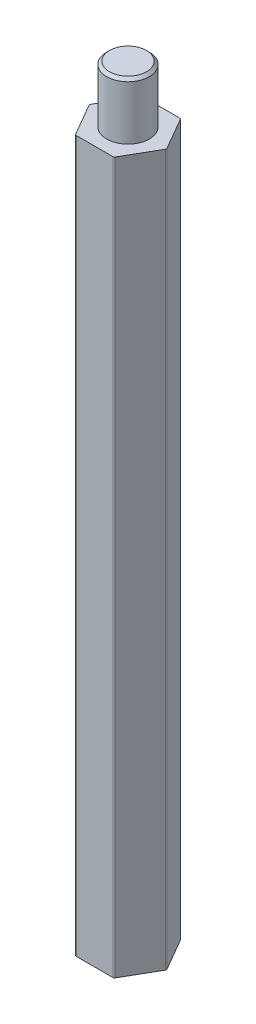
from build123d import *

# Parameters (mm, degrees)
EXTRUDE_1_DEPTH     = 50
SKETCH_2_R          = 1.5
EXTRUDE_2_DEPTH     = 4
SKETCH_3_R          = 1.5
CUT_EXTRUDE_1_DEPTH = 4
CHAMFER_1_SIZE      = 0.2
FILLET_1_R          = 0.1


with BuildPart() as part:
    # 草图1 → 凸台-拉伸1 (new body)
    with BuildSketch(Plane(origin=(0, 0, 0), x_dir=(1, 0, 0), z_dir=(0, 1, 0))):
        Polygon((2.713546265, 0), (1.356773133, 2.35), (-1.356773133, 2.35), (-2.713546265, 0), (-1.356773133, -2.35), (1.356773133, -2.35), align=None)
    extrude(amount=EXTRUDE_1_DEPTH)

    # 草图2 → 凸台-拉伸2 (add)
    with BuildSketch(Plane(origin=(0, 50, 0), x_dir=(1, 0, 0), z_dir=(0, 1, 0))):
        with Locations(Location((0, 0, 0), (0, 0, 270))):
            Circle(SKETCH_2_R)
    extrude(amount=EXTRUDE_2_DEPTH)

    # 草图3 → 切除-拉伸1 (cut)
    with BuildSketch(Plane.XZ):
        with Locations(Location((0, 0, 0), (0, 0, 90))):
            Circle(SKETCH_3_R)
    extrude(amount=-CUT_EXTRUDE_1_DEPTH, mode=Mode.SUBTRACT)

    # 倒角1
    chamfer_1_edges = [part.edges().sort_by_distance(p)[0] for p in [
        (0, 4, -1.5),
        (0, 54, -1.5),
    ]]
    chamfer(chamfer_1_edges, length=CHAMFER_1_SIZE)

    # 圆角1
    fillet_1_edges = [part.edges().sort_by_distance(p)[0] for p in [
        (2.713546265, 25, 0),
        (1.356773133, 25, -2.35),
        (1.356773133, 25, 2.35),
        (-1.356773133, 25, -2.35),
        (-1.356773133, 25, 2.35),
        (-2.713546265, 25, 0),
    ]]
    fillet(fillet_1_edges, radius=FILLET_1_R)


solid = part.part
